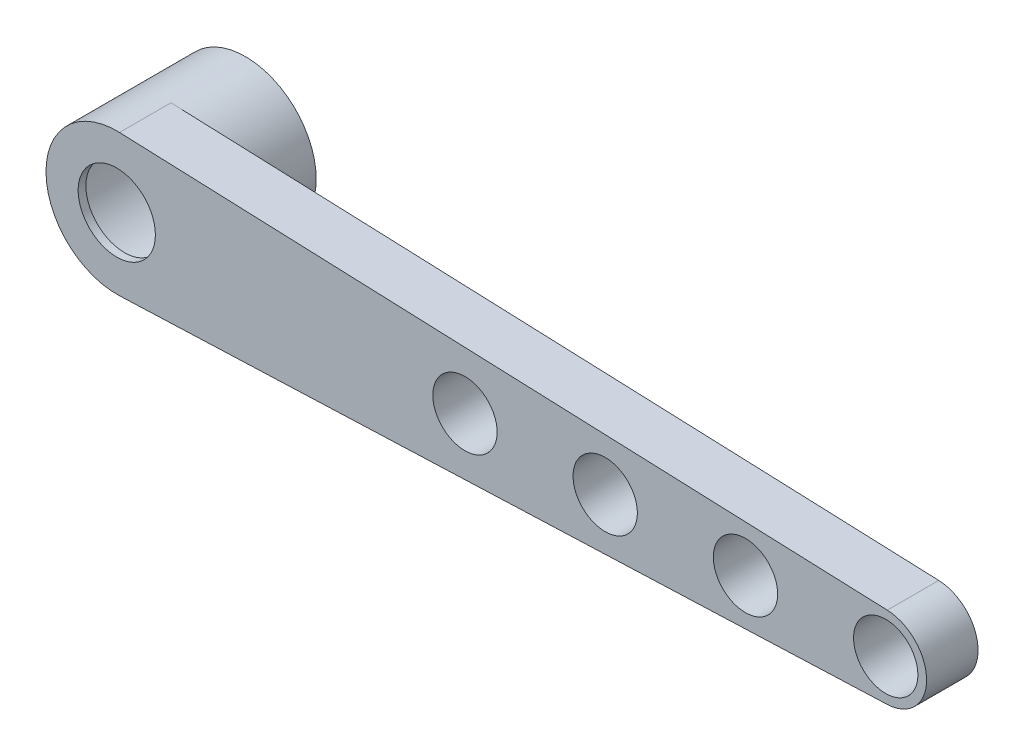
from build123d import *

# Parameters (mm, degrees)
SKETCH_1_R          = 2.75
EXTRUDE_1_DEPTH     = 5
SKETCH_2_R          = 2.5
CUT_EXTRUDE_1_DEPTH = 4.7
SKETCH_3_R          = 1.5
CUT_EXTRUDE_2_DEPTH = 4.7
EXTRUDE_START       = -2
SKETCH_4_R          = 1.25
EXTRUDE_3_DEPTH     = 2


with BuildPart() as part:
    # 草图1 → 凸台-拉伸1 (new body)
    with BuildSketch(Plane.XY):
        Circle(SKETCH_1_R)
    extrude(amount=EXTRUDE_1_DEPTH)

    # 草图2 → 切除-拉伸1 (cut)
    with BuildSketch(Plane(origin=(0, 0, 0), x_dir=(-1, 0, 0), z_dir=(0, 0, -1))):
        Circle(SKETCH_2_R)
    extrude(amount=-CUT_EXTRUDE_1_DEPTH, mode=Mode.SUBTRACT)

    # 草图3 → 切除-拉伸2 (cut)
    with BuildSketch(Plane.XY.offset(5)):
        Circle(SKETCH_3_R)
    extrude(amount=-CUT_EXTRUDE_2_DEPTH, mode=Mode.SUBTRACT)

    # 草图4 → 凸台-拉伸3 (add)
    with BuildSketch(Plane.XY.offset(5).offset(EXTRUDE_START)):
        with BuildLine():
            Line((29.941561076, 1.591009855), (0.106557862, 2.747934756))
            ThreePointArc((0.106557862, 2.747934756), (1.981859495, 1.906497558), (2.75, 0))
            ThreePointArc((2.75, 0), (1.982079977, -1.906268335), (0.10719348, -2.747910035))
            Line((0.10719348, -2.747910035), (29.94192829, -1.584084071))
            ThreePointArc((29.94192829, -1.584084071), (31.46874704, 0.003639496), (29.941561076, 1.591009855))
        make_face()
        with Locations((13.53, 0)):
            Circle(SKETCH_4_R, mode=Mode.SUBTRACT)
        with Locations((18.98, 0)):
            Circle(SKETCH_4_R, mode=Mode.SUBTRACT)
        with Locations((24.43, 0)):
            Circle(SKETCH_4_R, mode=Mode.SUBTRACT)
        with Locations((29.8799998, 0.003455751)):
            Circle(SKETCH_4_R, mode=Mode.SUBTRACT)
    extrude(amount=EXTRUDE_3_DEPTH)


solid = part.part
